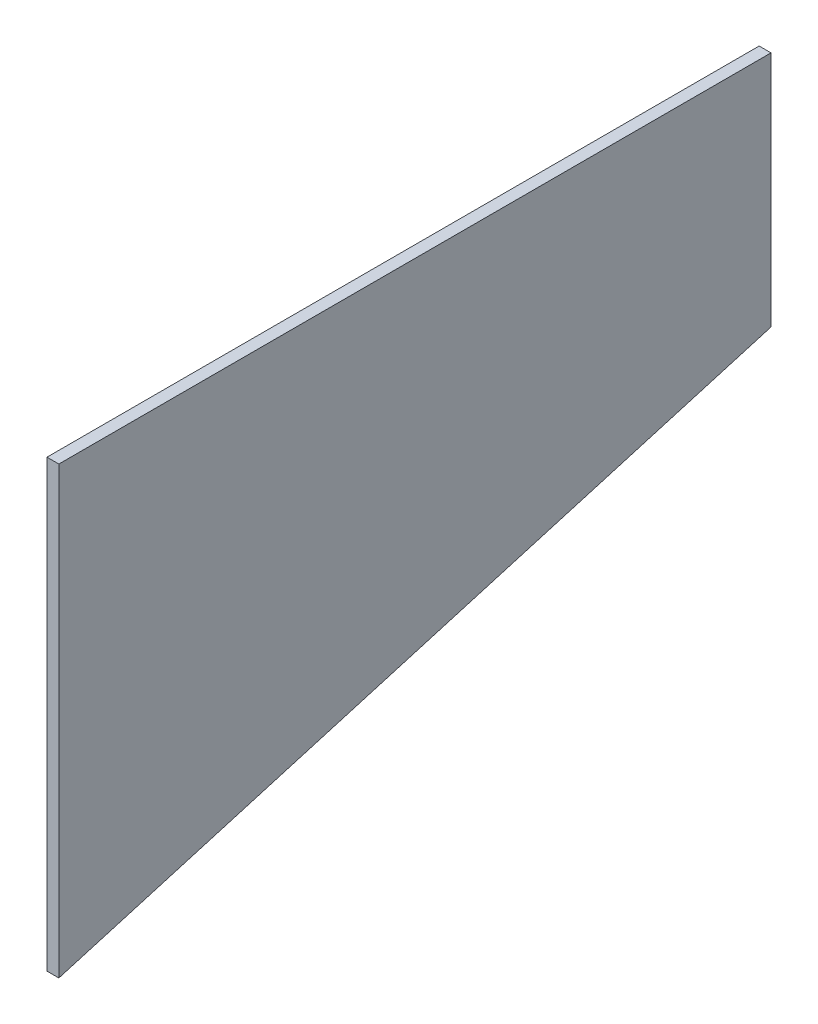
from build123d import *

# Parameters (mm, degrees)
BOSS_EXTRUDE1_DEPTH = 2


with BuildPart() as part:
    # Sketch2 → Boss-Extrude1 (new body)
    with BuildSketch(Plane(origin=(0, 0, 0), x_dir=(0, 0, -1), z_dir=(1, 0, 0))):
        Polygon((0, -75), (0, 0), (120, 0), (120, -40), align=None)
    extrude(amount=BOSS_EXTRUDE1_DEPTH)


solid = part.part
